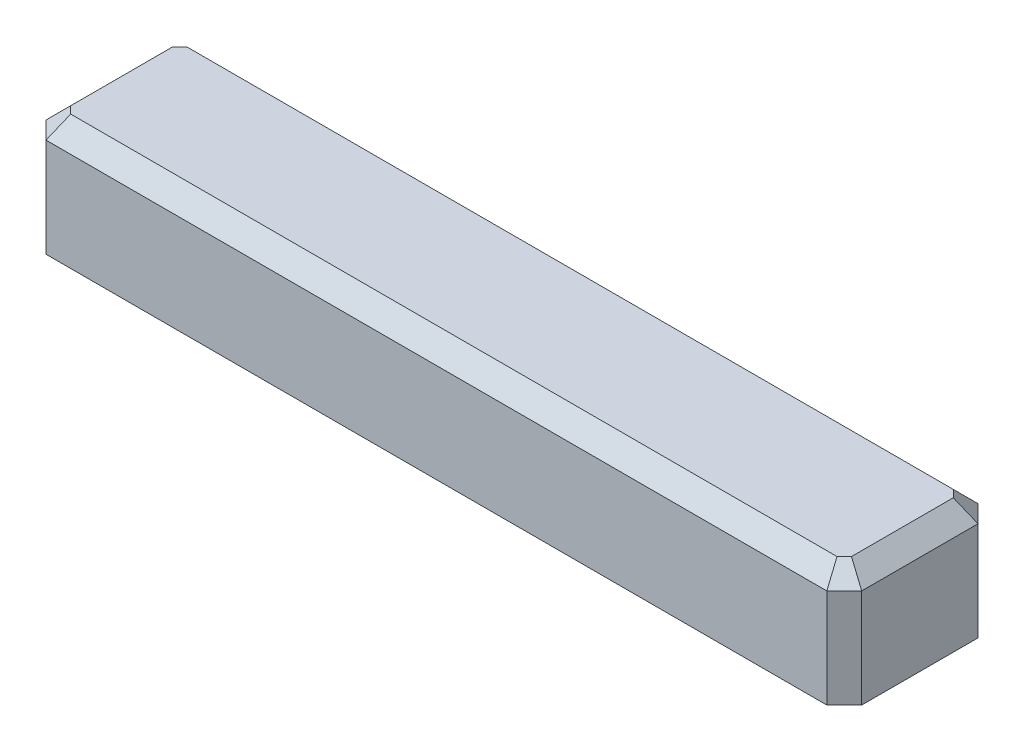
from build123d import *

# Parameters (mm, degrees)
BOSS_EXTRUDE1_DEPTH = 10
CHAMFER1_SIZE       = 1.5
SKETCH2_W           = 61.34
SKETCH2_H           = 3.8
CUT_EXTRUDE1_DEPTH  = 7


with BuildPart() as part:
    # Sketch1 → Boss-Extrude1 (new body)
    with BuildSketch(Plane(origin=(0, 0, 0), x_dir=(1, 0, 0), z_dir=(0, 1, 0))):
        Polygon((-35.07, 5), (-33.57, 6.5), (33.57, 6.5), (35.07, 5), (35.07, -5), (33.57, -6.5), (-33.57, -6.5), (-35.07, -5), align=None)
    extrude(amount=BOSS_EXTRUDE1_DEPTH)

    # Chamfer1
    chamfer1_edges = [part.edges().sort_by_distance(p)[0] for p in [
        (0, 10, 6.5),
        (34.32, 10, 5.75),
        (35.07, 10, 0),
        (34.32, 10, -5.75),
        (0, 10, -6.5),
        (-34.32, 10, -5.75),
        (-35.07, 10, 0),
        (-34.32, 10, 5.75),
    ]]
    chamfer(chamfer1_edges, length=CHAMFER1_SIZE)

    # Sketch2 → Cut-Extrude1 (cut)
    with BuildSketch(Plane.XZ):
        with Locations((0, -0.6)):
            Rectangle(SKETCH2_W, SKETCH2_H)
    extrude(amount=-CUT_EXTRUDE1_DEPTH, mode=Mode.SUBTRACT)


solid = part.part
